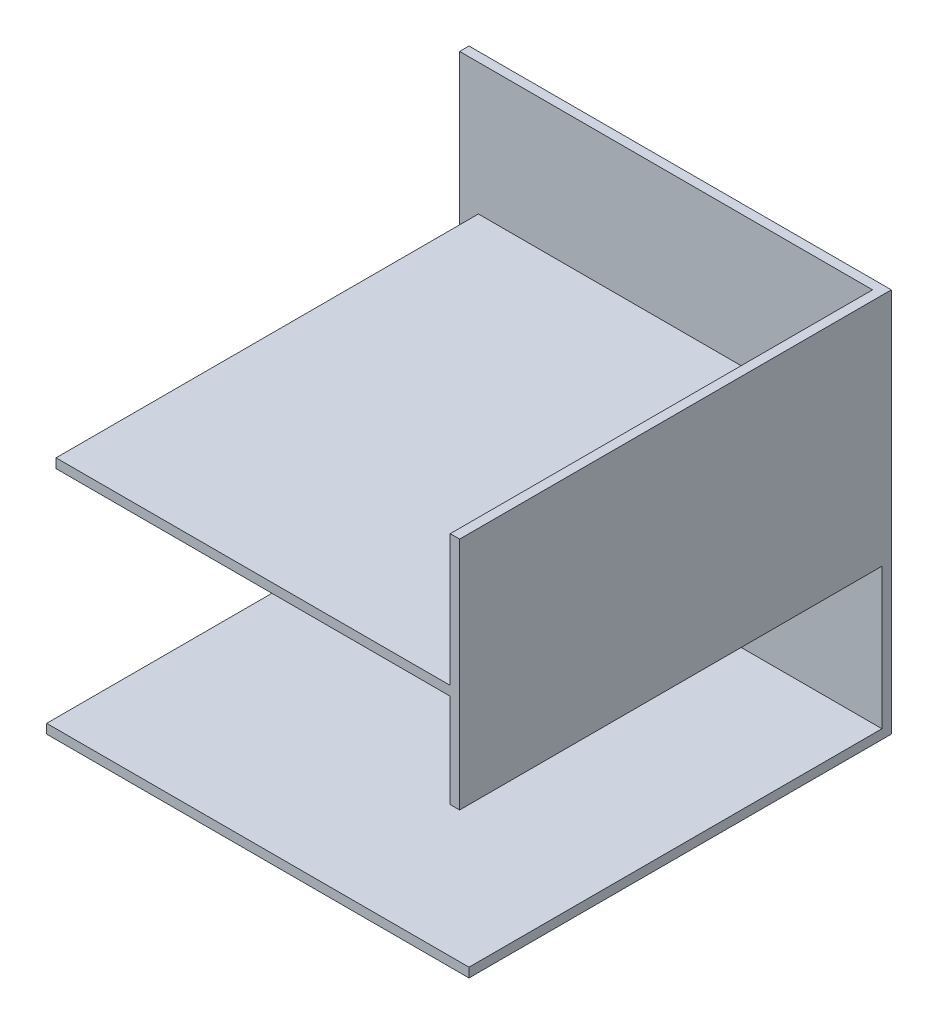
from build123d import *

# Parameters (mm, degrees)
SKETCH1_W           = 450
SKETCH1_H           = 10
BOSS_EXTRUDE1_DEPTH = 450
SKETCH2_W           = 450
SKETCH2_H           = 10
BOSS_EXTRUDE2_DEPTH = 400
SKETCH3_W           = 10
SKETCH3_H           = 250
BOSS_EXTRUDE3_DEPTH = 450
SKETCH4_W           = 420
SKETCH4_H           = 10
BOSS_EXTRUDE4_DEPTH = 450


with BuildPart() as part:
    # Sketch1 → Boss-Extrude1 (new body)
    with BuildSketch(Plane.XY):
        with Locations((202.060737527, -0.246746204)):
            Rectangle(SKETCH1_W, SKETCH1_H)
    extrude(amount=BOSS_EXTRUDE1_DEPTH)

    # Sketch2 → Boss-Extrude2 (add)
    with BuildSketch(Plane(origin=(0, 4.753253796, 0), x_dir=(1, 0, 0), z_dir=(0, 1, 0))):
        with Locations((202.060737527, -5)):
            Rectangle(SKETCH2_W, SKETCH2_H)
    extrude(amount=BOSS_EXTRUDE2_DEPTH)

    # Sketch3 → Boss-Extrude3 (add)
    with BuildSketch(Plane.XY.offset(10)):
        with Locations((422.060737527, 279.753253796)):
            Rectangle(SKETCH3_W, SKETCH3_H)
    extrude(amount=BOSS_EXTRUDE3_DEPTH)

    # Sketch4 → Boss-Extrude4 (add)
    with BuildSketch(Plane.XY.offset(10)):
        with Locations((207.060737527, 259.753253796)):
            Rectangle(SKETCH4_W, SKETCH4_H)
    extrude(amount=BOSS_EXTRUDE4_DEPTH)


solid = part.part
